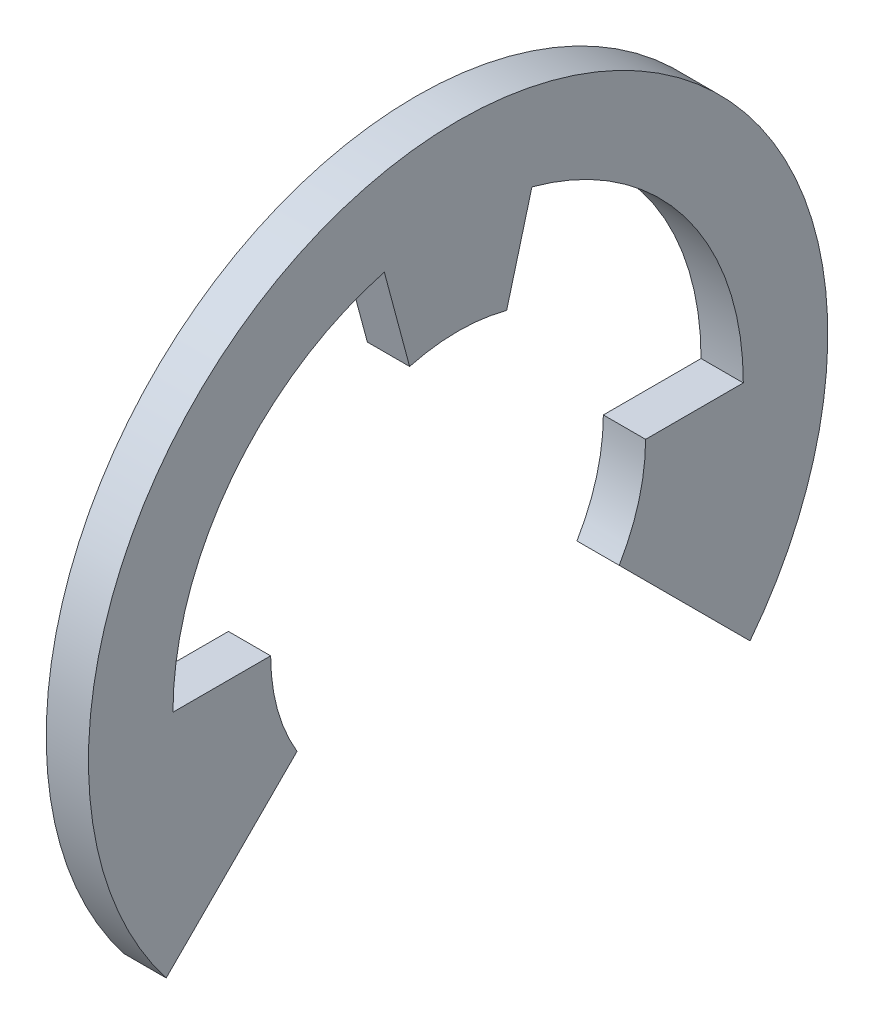
from build123d import *

# Parameters (mm, degrees)
BOSS_EXTRUDE1_DEPTH = 0.8


with BuildPart() as part:
    # Sketch1 → Boss-Extrude1 (new body)
    with BuildSketch(Plane(origin=(0, 0, 0), x_dir=(0, 0, -1), z_dir=(1, 0, 0))):
        with BuildLine():
            Line((-3.55, 0), (-5.4, 0))
            ThreePointArc((-5.4, 0), (-4.284108038, 3.287311717), (-1.397622844, 5.215999462))
            Line((-1.397622844, 5.215999462), (-0.91880761, 3.429036683))
            ThreePointArc((-0.91880761, 3.429036683), (0, 3.55), (0.91880761, 3.429036683))
            Line((0.91880761, 3.429036683), (1.397622844, 5.215999462))
            ThreePointArc((1.397622844, 5.215999462), (4.284108038, 3.287311717), (5.4, 0))
            Line((5.4, 0), (3.55, 0))
            ThreePointArc((3.55, 0), (3.422718218, -0.942072184), (3.05, -1.816590212))
            Line((3.05, -1.816590212), (5.527883477, -4.294473689))
            ThreePointArc((5.527883477, -4.294473689), (0, 7), (-5.527883477, -4.294473689))
            Line((-5.527883477, -4.294473689), (-3.05, -1.816590212))
            ThreePointArc((-3.05, -1.816590212), (-3.422718218, -0.942072184), (-3.55, 0))
        make_face()
    extrude(amount=BOSS_EXTRUDE1_DEPTH)


solid = part.part
